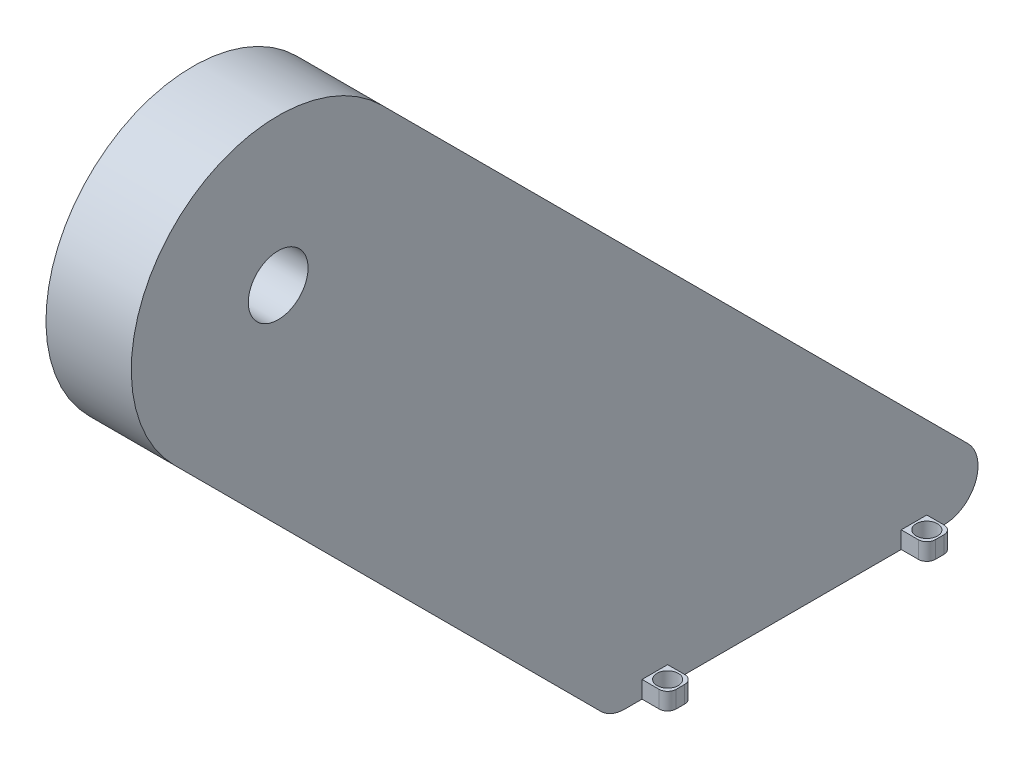
from build123d import *

# Parameters (mm, degrees)
SKETCH1_R           = 3.5
BOSS_EXTRUDE2_DEPTH = 10
SKETCH2_W           = 3
SKETCH2_H           = 3
SKETCH2_R           = 1.25
BOSS_EXTRUDE3_DEPTH = 2
FILLET2_R           = 1
FILLET6_R           = 1
FILLET7_R           = 1


with BuildPart() as part:
    # Sketch1 → Boss-Extrude2 (new body)
    with BuildSketch(Plane(origin=(0, 0, 0), x_dir=(0, 0, -1), z_dir=(1, 0, 0))):
        with BuildLine():
            Line((0, 0), (-13.343145751, 0))
            ThreePointArc((-13.343145751, 0), (-14.87387948, 0.30448187), (-16.171572875, 1.171572875))
            Line((-16.171572875, 1.171572875), (-66.154328925, 51.154328925))
            ThreePointArc((-66.154328925, 51.154328925), (-66.154328925, 75.497474674), (-41.811183175, 75.497474674))
            Line((-41.811183175, 75.497474674), (26.857864374, 6.828427125))
            ThreePointArc((26.857864374, 6.828427125), (27.72495538, 2.469266271), (24.029437249, 0))
            Line((24.029437249, 0), (0, 0))
        make_face()
        with Locations((-53.98275605, 63.3259018)):
            Circle(SKETCH1_R, mode=Mode.SUBTRACT)
    extrude(amount=BOSS_EXTRUDE2_DEPTH)

    # Sketch2 → Boss-Extrude3 (add)
    # profile 1 of 2: a face of its own
    with BuildSketch(Plane.XZ):
        with Locations((11.5, 9.843145751)):
            Rectangle(SKETCH2_W, SKETCH2_H)
        with Locations(Location((11.5, 9.843145751, 0), (0, 0, 270))):
            Circle(SKETCH2_R, mode=Mode.SUBTRACT)
    # profile 2 of 2: a face of its own
    with BuildSketch(Plane.XZ):
        with Locations((11.5, -20.529437249)):
            Rectangle(SKETCH2_W, SKETCH2_H)
        with Locations(Location((11.5, -20.529437249, 0), (0, 0, 270))):
            Circle(SKETCH2_R, mode=Mode.SUBTRACT)
    extrude(amount=-BOSS_EXTRUDE3_DEPTH)

    # Fillet2
    fillet2_edges = [part.edges().sort_by_distance(p)[0] for p in [
        (13, 1, 11.343145751),
    ]]
    fillet(fillet2_edges, radius=FILLET2_R)

    # Fillet6
    fillet6_edges = [part.edges().sort_by_distance(p)[0] for p in [
        (13, 1, 8.343145751),
    ]]
    fillet(fillet6_edges, radius=FILLET6_R)

    # Fillet7
    fillet7_edges = [part.edges().sort_by_distance(p)[0] for p in [
        (13, 1, -19.029437249),
        (13, 1, -22.029437249),
    ]]
    fillet(fillet7_edges, radius=FILLET7_R)


solid = part.part
